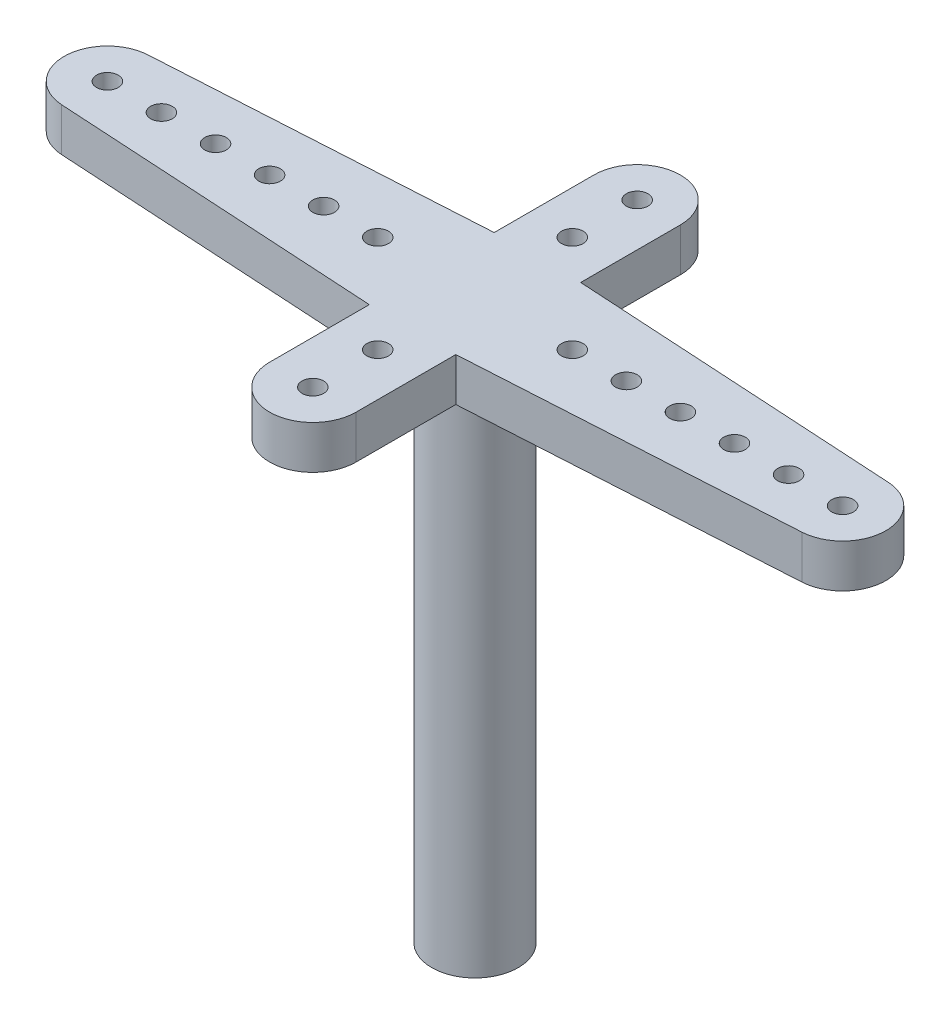
from build123d import *

# Parameters (mm, degrees)
SKETCH1_R           = 2
SKETCH1_R_2         = 0.5
BOSS_EXTRUDE1_DEPTH = 2
BOSS_EXTRUDE2_START = -24
SKETCH1_3_R         = 2
BOSS_EXTRUDE2_DEPTH = 26


with BuildPart() as part:
    # Sketch1 → Boss-Extrude1 (new body)
    with BuildSketch(Plane(origin=(0, 0, 0), x_dir=(1, 0, 0), z_dir=(0, 1, 0))):
        with BuildLine():
            Line((2, 7.5), (2, 2.88735269))
            Line((2, 2.88735269), (17.117647059, 1.996536794))
            ThreePointArc((17.117647059, 1.996536794), (19, 0), (17.117647059, -1.996536794))
            Line((17.117647059, -1.996536794), (2, -2.88735269))
            Line((2, -2.88735269), (2, -7.5))
            ThreePointArc((2, -7.5), (0, -9.5), (-2, -7.5))
            Line((-2, -7.5), (-2, -2.88735269))
            Line((-2, -2.88735269), (-17.117647059, -1.996536794))
            ThreePointArc((-17.117647059, -1.996536794), (-19, 0), (-17.117647059, 1.996536794))
            Line((-17.117647059, 1.996536794), (-2, 2.88735269))
            Line((-2, 2.88735269), (-2, 7.5))
            ThreePointArc((-2, 7.5), (0, 9.5), (2, 7.5))
        make_face()
        with Locations(Location((0, 0, 0), (0, 0, 270))):
            Circle(SKETCH1_R, mode=Mode.SUBTRACT)
        with Locations(Location((-17, 0, 0), (0, 0, 270))):
            Circle(SKETCH1_R_2, mode=Mode.SUBTRACT)
        with Locations(Location((17, 0, 0), (0, 0, 90))):
            Circle(SKETCH1_R_2, mode=Mode.SUBTRACT)
        with Locations(Location((-14.5, 0, 0), (0, 0, 270))):
            Circle(SKETCH1_R_2, mode=Mode.SUBTRACT)
        with Locations(Location((-12, 0, 0), (0, 0, 270))):
            Circle(SKETCH1_R_2, mode=Mode.SUBTRACT)
        with Locations(Location((-9.5, 0, 0), (0, 0, 270))):
            Circle(SKETCH1_R_2, mode=Mode.SUBTRACT)
        with Locations(Location((-7, 0, 0), (0, 0, 270))):
            Circle(SKETCH1_R_2, mode=Mode.SUBTRACT)
        with Locations(Location((-4.5, 0, 0), (0, 0, 270))):
            Circle(SKETCH1_R_2, mode=Mode.SUBTRACT)
        with Locations(Location((4.5, 0, 0), (0, 0, 90))):
            Circle(SKETCH1_R_2, mode=Mode.SUBTRACT)
        with Locations(Location((7, 0, 0), (0, 0, 90))):
            Circle(SKETCH1_R_2, mode=Mode.SUBTRACT)
        with Locations(Location((9.5, 0, 0), (0, 0, 90))):
            Circle(SKETCH1_R_2, mode=Mode.SUBTRACT)
        with Locations(Location((12, 0, 0), (0, 0, 90))):
            Circle(SKETCH1_R_2, mode=Mode.SUBTRACT)
        with Locations(Location((14.5, 0, 0), (0, 0, 90))):
            Circle(SKETCH1_R_2, mode=Mode.SUBTRACT)
        with Locations(Location((0, 7.5, 0), (0, 0, 270))):
            Circle(SKETCH1_R_2, mode=Mode.SUBTRACT)
        with Locations(Location((0, 4.5, 0), (0, 0, 270))):
            Circle(SKETCH1_R_2, mode=Mode.SUBTRACT)
        with Locations(Location((0, -4.5, 0), (0, 0, 90))):
            Circle(SKETCH1_R_2, mode=Mode.SUBTRACT)
        with Locations(Location((0, -7.5, 0), (0, 0, 90))):
            Circle(SKETCH1_R_2, mode=Mode.SUBTRACT)
    extrude(amount=BOSS_EXTRUDE1_DEPTH)

    # Sketch1<3> → Boss-Extrude2 (add)
    with BuildSketch(Plane(origin=(0, 0, 0), x_dir=(1, 0, 0), z_dir=(0, 1, 0)).offset(BOSS_EXTRUDE2_START)):
        with Locations(Location((0, 0, 0), (0, 0, 270))):
            Circle(SKETCH1_3_R)
    extrude(amount=BOSS_EXTRUDE2_DEPTH)


solid = part.part
